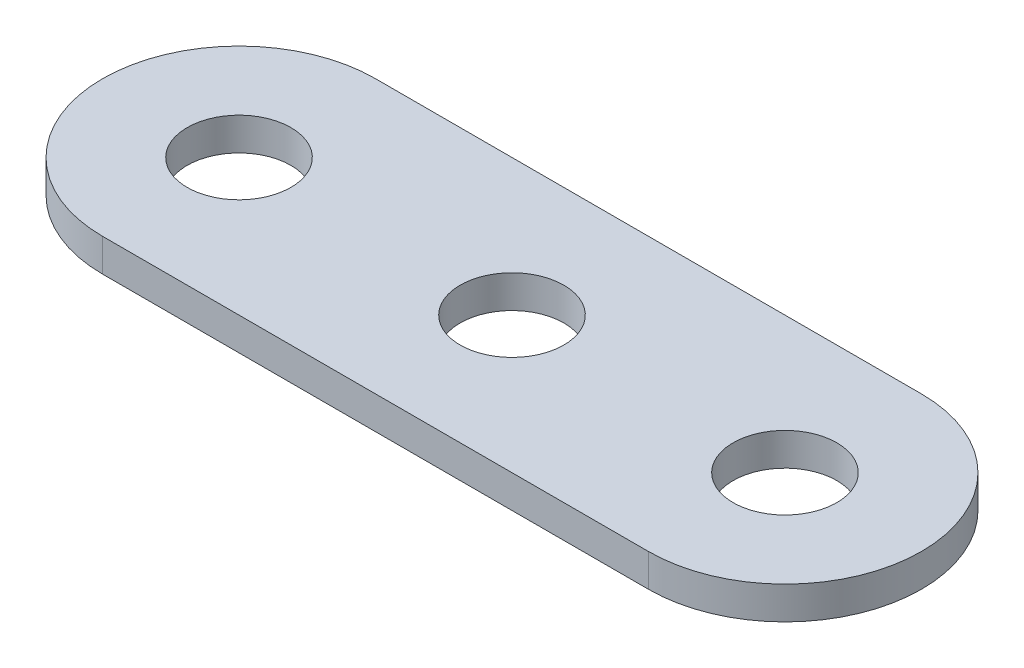
from build123d import *

# Parameters (mm, degrees)
SKETCH1_R           = 2.413
BOSS_EXTRUDE1_DEPTH = 1.524


with BuildPart() as part:
    # Sketch1 → Boss-Extrude1 (new body)
    with BuildSketch(Plane(origin=(0, 0, 0), x_dir=(1, 0, 0), z_dir=(0, 1, 0))):
        with BuildLine():
            Line((0, 6.35), (-25.4, 6.35))
            ThreePointArc((-25.4, 6.35), (-31.75, 0), (-25.4, -6.35))
            Line((-25.4, -6.35), (0, -6.35))
            ThreePointArc((0, -6.35), (6.35, 0), (0, 6.35))
        make_face()
        with Locations(Location((-25.4, 0, 0), (0, 0, 90))):
            Circle(SKETCH1_R, mode=Mode.SUBTRACT)
        with Locations(Location((-12.7, 0, 0), (0, 0, 90))):
            Circle(SKETCH1_R, mode=Mode.SUBTRACT)
        with Locations(Location((0, 0, 0), (0, 0, 90))):
            Circle(SKETCH1_R, mode=Mode.SUBTRACT)
    extrude(amount=BOSS_EXTRUDE1_DEPTH)


solid = part.part
